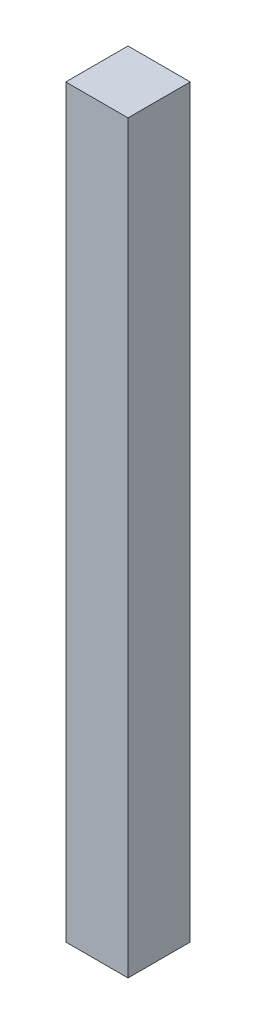
from build123d import *

# Parameters (mm, degrees)
SKETCH1_W           = 50.8
SKETCH1_H           = 50.8
BOSS_EXTRUDE1_DEPTH = 608.0125


with BuildPart() as part:
    # Sketch1 → Boss-Extrude1 (new body)
    with BuildSketch(Plane(origin=(0, 0, 0), x_dir=(1, 0, 0), z_dir=(0, 1, 0))):
        Rectangle(SKETCH1_W, SKETCH1_H)
    extrude(amount=BOSS_EXTRUDE1_DEPTH)


solid = part.part
